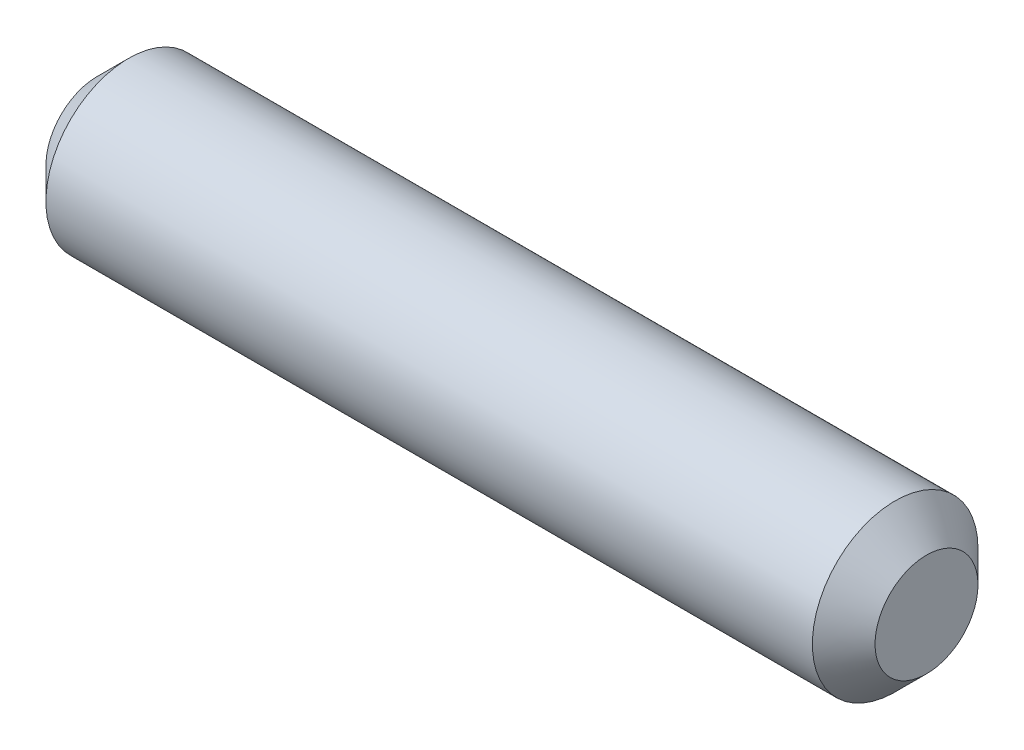
from build123d import *

# Parameters (mm, degrees)
SKETCH1_R           = 1.585
BOSS_EXTRUDE1_DEPTH = 7.935
CHAMFER1_SIZE       = 0.6


with BuildPart() as part:
    # Sketch1 → Boss-Extrude1 (new, symmetric)
    with BuildSketch(Plane(origin=(0, 0, 0), x_dir=(0, 0, -1), z_dir=(1, 0, 0))):
        Circle(SKETCH1_R)
    extrude(amount=BOSS_EXTRUDE1_DEPTH, both=True)

    # Chamfer1
    chamfer1_edges = [part.edges().sort_by_distance(p)[0] for p in [
        (-7.935, 0, 1.585),
        (7.935, 0, 1.585),
    ]]
    chamfer(chamfer1_edges, length=CHAMFER1_SIZE)


solid = part.part
